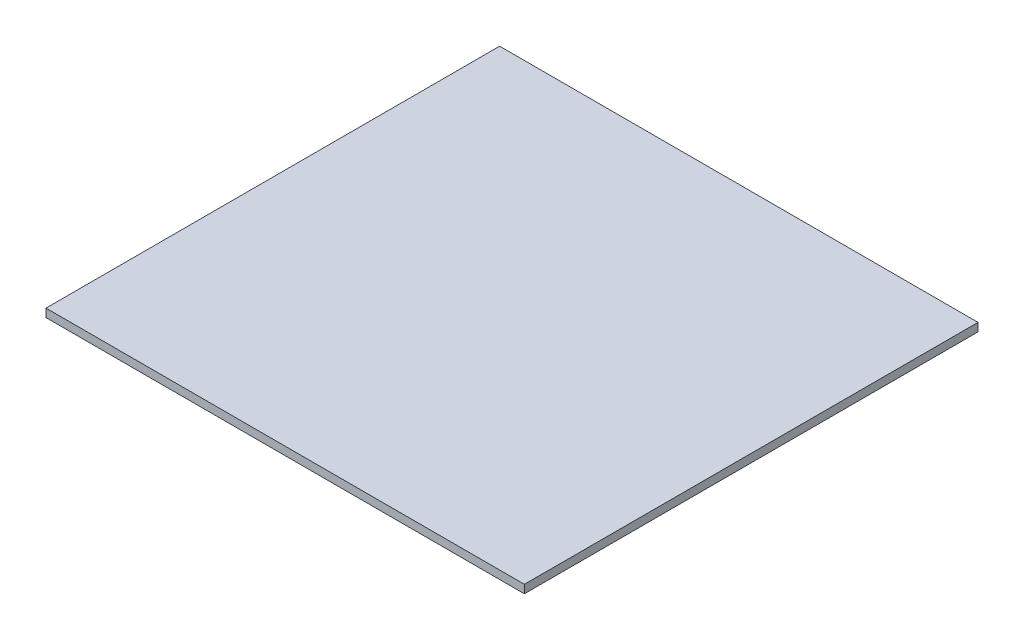
from build123d import *

# Parameters (mm, degrees)
OVEN_KESME_ZEMIN_PLAKASI_1_START = -30
SKETCH1_W                        = 580
SKETCH1_H                        = 10
OVEN_KESME_ZEMIN_PLAKASI_1_DEPTH = 550


with BuildPart() as part:
    # Sketch1 → OVEN_kesme_zemin_plakasi_1 (new body)
    with BuildSketch(Plane.XY.offset(OVEN_KESME_ZEMIN_PLAKASI_1_START)):
        with Locations((350, 335)):
            Rectangle(SKETCH1_W, SKETCH1_H)
    extrude(amount=-OVEN_KESME_ZEMIN_PLAKASI_1_DEPTH)


solid = part.part
